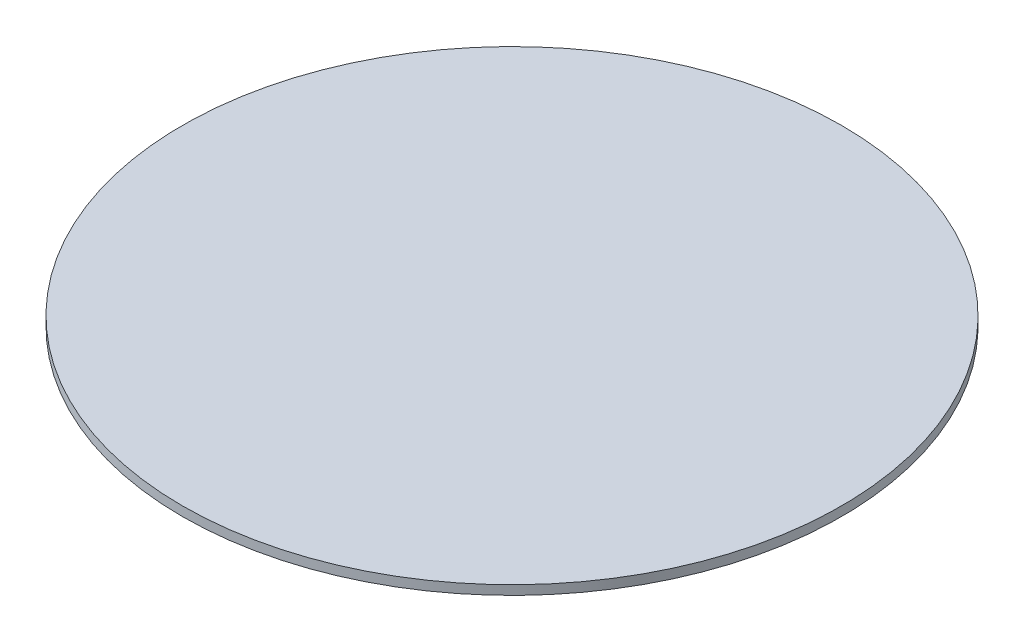
from build123d import *

# Parameters (mm, degrees)
SKETCH_1_R      = 71
EXTRUDE_1_DEPTH = 2


with BuildPart() as part:
    # 草圖1 → 填料-伸長1 (new body)
    with BuildSketch(Plane(origin=(0, 0, 0), x_dir=(1, 0, 0), z_dir=(0, 1, 0))):
        with Locations(Location((0, 0, 0), (0, 0, 270))):
            Circle(SKETCH_1_R)
    extrude(amount=EXTRUDE_1_DEPTH)


solid = part.part
